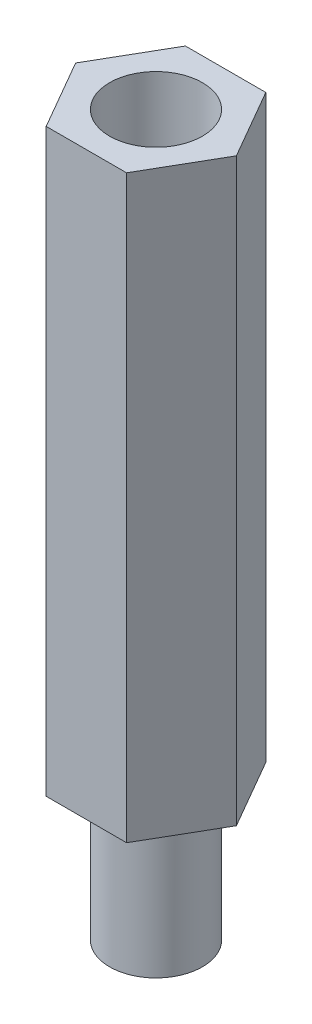
from build123d import *

# Parameters (mm, degrees)
SKETCH_1_R           = 2
EXTRUDE_1_DEPTH      = 25
EXTRUDE_2_DEPTH      = 6
EXTRUDE_2_DEPTH_BACK = 5
SKETCH_2_R           = 2


with BuildPart() as part:
    # 草图1 → 凸台-拉伸1 (new body)
    with BuildSketch(Plane(origin=(0, 0, 0), x_dir=(1, 0, 0), z_dir=(0, 1, 0))):
        Polygon((3.464101615, 0), (1.732050808, 3), (-1.732050808, 3), (-3.464101615, 0), (-1.732050808, -3), (1.732050808, -3), align=None)
        with Locations(Location((0, 0, 0), (0, 0, 270))):
            Circle(SKETCH_1_R, mode=Mode.SUBTRACT)
    extrude(amount=EXTRUDE_1_DEPTH)

    # 草图2 → 凸台-拉伸2 (add, two sides: drawn at the far end of the back side and taken through both)
    with BuildSketch(Plane.XZ.offset(-EXTRUDE_2_DEPTH_BACK)):
        with Locations(Location((0, 0, 0), (0, 0, 270))):
            Circle(SKETCH_2_R)
    extrude(amount=EXTRUDE_2_DEPTH + EXTRUDE_2_DEPTH_BACK)


solid = part.part
